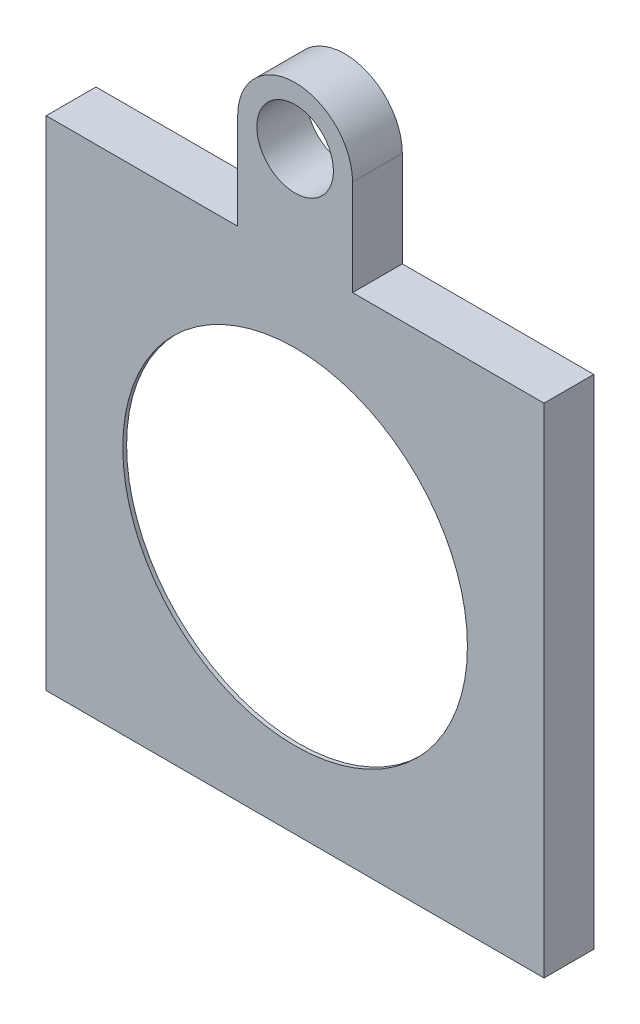
from build123d import *

# Parameters (mm, degrees)
SKETCH_1_W          = 13
SKETCH_1_H          = 13
SKETCH_1_W_2        = 12
SKETCH_1_H_2        = 12
EXTRUDE_1_DEPTH     = 1.2
SKETCH_2_W          = 13
SKETCH_2_H          = 13
SKETCH_2_R          = 4.5
EXTRUDE_2_DEPTH     = 0.1
SKETCH_3_W          = 3
SKETCH_3_H          = 1.3
EXTRUDE_3_DEPTH     = 4
CUT_EXTRUDE_1_DEPTH = 4
SKETCH_5_R          = 1
CUT_EXTRUDE_2_DEPTH = 4


with BuildPart() as part:
    # 草图1 → 凸台-拉伸1 (new body)
    with BuildSketch(Plane.XY):
        Rectangle(SKETCH_1_W, SKETCH_1_H)
        Rectangle(SKETCH_1_W_2, SKETCH_1_H_2, mode=Mode.SUBTRACT)
    extrude(amount=EXTRUDE_1_DEPTH)

    # 草图2 → 凸台-拉伸2 (add)
    with BuildSketch(Plane.XY.offset(1.2)):
        Rectangle(SKETCH_2_W, SKETCH_2_H)
        Circle(SKETCH_2_R, mode=Mode.SUBTRACT)
    extrude(amount=EXTRUDE_2_DEPTH)

    # 草图3 → 凸台-拉伸3 (add)
    with BuildSketch(Plane(origin=(0, 6.5, 0), x_dir=(1, 0, 0), z_dir=(0, 1, 0))):
        with Locations((0, -0.65)):
            Rectangle(SKETCH_3_W, SKETCH_3_H)
    extrude(amount=EXTRUDE_3_DEPTH)

    # 草图4 → 切除-拉伸1 (cut)
    with BuildSketch(Plane.XY.offset(1.3)):
        with BuildLine():
            Line((-1.5, 10.5), (-1.5, 9))
            ThreePointArc((-1.5, 9), (-1.060660172, 10.060660172), (0, 10.5))
            Line((0, 10.5), (-1.5, 10.5))
        make_face()
        with BuildLine():
            ThreePointArc((0, 10.5), (1.060660172, 10.060660172), (1.5, 9))
            Line((1.5, 9), (1.5, 10.5))
            Line((1.5, 10.5), (0, 10.5))
        make_face()
    extrude(amount=-CUT_EXTRUDE_1_DEPTH, mode=Mode.SUBTRACT)

    # 草图5 → 切除-拉伸2 (cut)
    with BuildSketch(Plane.XY.offset(1.3)):
        with Locations((0, 9)):
            Circle(SKETCH_5_R)
    extrude(amount=-CUT_EXTRUDE_2_DEPTH, mode=Mode.SUBTRACT)


solid = part.part
